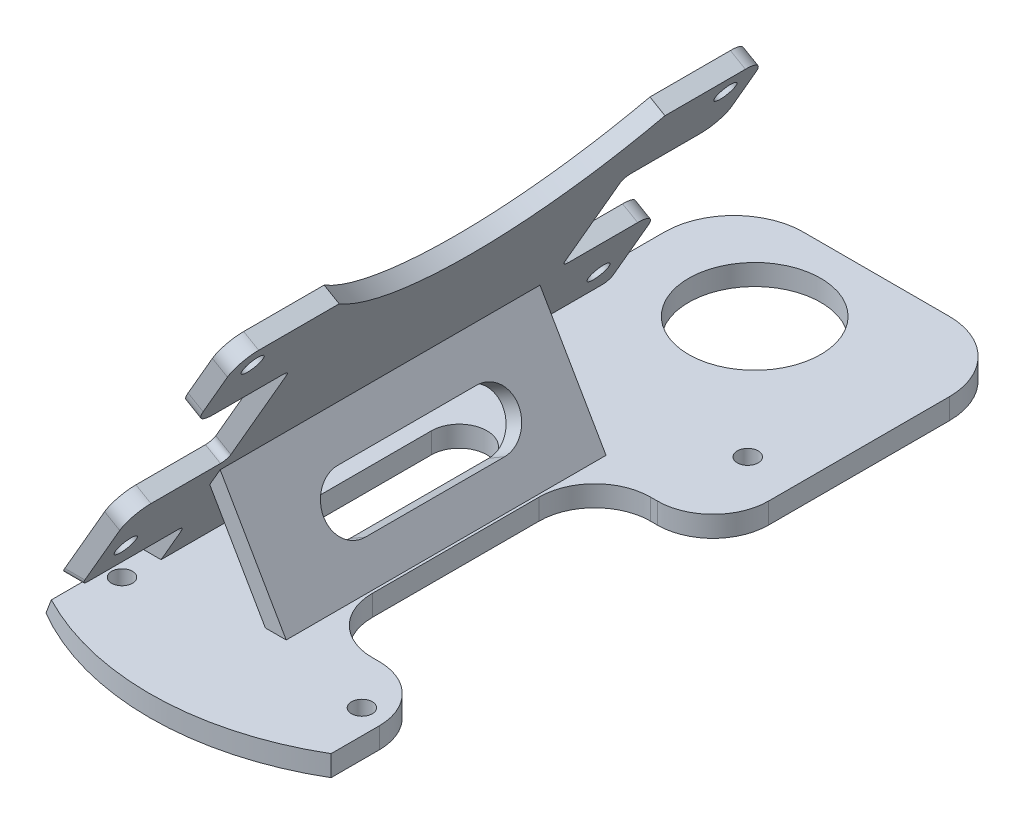
from build123d import *

# Parameters (mm, degrees)
EXTRUDE_1_DEPTH      = 38
EXTRUDE_1_DEPTH_BACK = 38
EXTRUDE_2_DEPTH      = 60
SKETCH_4_R           = 1.5
SKETCH_4_W           = 14
SKETCH_4_H           = 18
CUT_EXTRUDE_1_DEPTH  = 6
CUT_EXTRUDE_3_DEPTH  = 14
FILLET_2_R           = 3
CUT_EXTRUDE_6_DEPTH  = 3
SKETCH_13_R          = 1.5
CUT_EXTRUDE_7_DEPTH  = 10
CUT_EXTRUDE_9_DEPTH  = 15
SKETCH_17_W          = 41
SKETCH_17_H          = 26
SKETCH_17_R          = 9.5
SKETCH_17_R_2        = 1.5
EXTRUDE_3_DEPTH      = 3
FILLET_3_R           = 10
SKETCH_18_W          = 17
SKETCH_18_H          = 40
CUT_EXTRUDE_10_DEPTH = 10
FILLET_4_R           = 8
CUT_EXTRUDE_11_DEPTH = 4
FILLET_5_R           = 1
CUT_EXTRUDE_12_DEPTH = 10


with BuildPart() as part:
    # 草图2 → 凸台-拉伸1 (new, two sides: drawn at the far end of the back side and taken through both)
    with BuildSketch(Plane.XY.offset(-EXTRUDE_1_DEPTH_BACK)):
        Polygon((0, 0), (28.5, 49.363448016), (30.665063509, 48.113448016), (4.618802154, 3), (41, 3), (41, 0), align=None)
    extrude(amount=EXTRUDE_1_DEPTH + EXTRUDE_1_DEPTH_BACK)

    # 草图3 → 凸台-拉伸2 (add)
    with BuildSketch(Plane.XY.offset(38)):
        Polygon((12.618802154, 16.856406461), (14.118802154, 19.454482672), (23.618802154, 3), (20.618802154, 3), align=None)
    extrude(amount=-EXTRUDE_2_DEPTH)

    # 草图4 → 切除-拉伸1 (cut)
    with BuildSketch(Plane(origin=(0, 0, 0), x_dir=(0, 0, 1), z_dir=(-0.8660254037844365, 0.500000000000004, 0))):
        with Locations((34, 53.25)):
            Circle(SKETCH_4_R)
        with Locations((34, 16.75)):
            Circle(SKETCH_4_R)
        with Locations((-34, 16.75)):
            Circle(SKETCH_4_R)
        with Locations((-34, 53.25)):
            Circle(SKETCH_4_R)
        with Locations((31, 35)):
            Rectangle(SKETCH_4_W, SKETCH_4_H)
        with Locations((-31, 35)):
            Rectangle(SKETCH_4_W, SKETCH_4_H)
    extrude(amount=-CUT_EXTRUDE_1_DEPTH, mode=Mode.SUBTRACT)

    # 草图6 → 切除-拉伸3 (cut)
    with BuildSketch(Plane.XY.offset(38)):
        Polygon((23.618802154, 3), (14.118802154, 19.454482672), (12.618802154, 16.856406461), (20.618802154, 3), align=None)
    extrude(amount=-CUT_EXTRUDE_3_DEPTH, mode=Mode.SUBTRACT)

    # 圆角2
    fillet_2_edges = [part.edges().sort_by_distance(p)[0] for p in [
        (29.582531755, 48.738448016, -38),
        (23.082531755, 37.480117767, -38),
        (29.582531755, 48.738448016, 38),
        (23.082531755, 37.480117767, 38),
        (14.082531755, 21.891660498, 38),
        (14.082531755, 21.891660498, -38),
    ]]
    fillet(fillet_2_edges, radius=FILLET_2_R)

    # 草图11 → 切除-拉伸6 (cut)
    with BuildSketch(Plane(origin=(19.013139721, 10.977241336, 0), x_dir=(0, 0, -1), z_dir=(0.8660254037844374, 0.5000000000000022, 0))):
        with BuildLine():
            Line((-10, 4), (10, 4))
            ThreePointArc((10, 4), (14, 0), (10, -4))
            Line((10, -4), (-10, -4))
            ThreePointArc((-10, -4), (-14, 0), (-10, 4))
        make_face()
    extrude(amount=-CUT_EXTRUDE_6_DEPTH, mode=Mode.SUBTRACT)

    # 草图13 → 切除-拉伸7 (cut)
    with BuildSketch(Plane(origin=(0, 3, 0), x_dir=(1, 0, 0), z_dir=(0, 1, 0))):
        with Locations((37.5, -27)):
            Circle(SKETCH_13_R)
        with Locations((4, -28)):
            Circle(SKETCH_13_R)
        with Locations((34, 32)):
            Circle(SKETCH_13_R)
        with Locations((4, 32)):
            Circle(SKETCH_13_R)
    extrude(amount=-CUT_EXTRUDE_7_DEPTH, mode=Mode.SUBTRACT)

    # 草图15 → 切除-拉伸9 (cut)
    with BuildSketch(Plane.XY.offset(38)):
        Polygon((4.618802154, 3), (1.732050808, 3), (5.196152423, 9), (8.082903769, 9), align=None)
    cut_extrude_9 = extrude(amount=-CUT_EXTRUDE_9_DEPTH, mode=Mode.SUBTRACT)

    # 镜向1: 切除-拉伸9 across plane
    add(cut_extrude_9.mirror(Plane.XY), mode=Mode.SUBTRACT)

    # 草图17 → 凸台-拉伸3 (add)
    # profile 1 of 2: a face of its own
    with BuildSketch(Plane(origin=(0, 3, 0), x_dir=(1, 0, 0), z_dir=(0, 1, 0))):
        with Locations((20.5, 51)):
            Rectangle(SKETCH_17_W, SKETCH_17_H)
        with Locations((17, 50)):
            Circle(SKETCH_17_R, mode=Mode.SUBTRACT)
    # profile 2 of 2: a face of its own
    with BuildSketch(Plane(origin=(0, 3, 0), x_dir=(1, 0, 0), z_dir=(0, 1, 0))):
        with Locations((20.5, -51)):
            Rectangle(SKETCH_17_W, SKETCH_17_H)
        with Locations((5, -45)):
            Circle(SKETCH_17_R_2, mode=Mode.SUBTRACT)
        with Locations((5, -55)):
            Circle(SKETCH_17_R_2, mode=Mode.SUBTRACT)
        with Locations((35, -55)):
            Circle(SKETCH_17_R_2, mode=Mode.SUBTRACT)
        with Locations((35, -45)):
            Circle(SKETCH_17_R_2, mode=Mode.SUBTRACT)
        with Locations((20, -50)):
            Circle(SKETCH_17_R, mode=Mode.SUBTRACT)
    extrude(amount=-EXTRUDE_3_DEPTH)

    # 圆角3
    fillet_3_edges = [part.edges().sort_by_distance(p)[0] for p in [
        (41, 1.5, -64),
        (0, 1.5, -64),
        (41, 1.5, 64),
        (0, 1.5, 64),
    ]]
    fillet(fillet_3_edges, radius=FILLET_3_R)

    # 草图18 → 切除-拉伸10 (cut)
    with BuildSketch(Plane(origin=(0, 3, 0), x_dir=(1, 0, 0), z_dir=(0, 1, 0))):
        with Locations((32.5, 0)):
            Rectangle(SKETCH_18_W, SKETCH_18_H)
        with BuildLine():
            Line((8, -12.5), (8, 12.5))
            ThreePointArc((8, 12.5), (12, 16.5), (16, 12.5))
            Line((16, 12.5), (16, -12.5))
            ThreePointArc((16, -12.5), (12, -16.5), (8, -12.5))
        make_face()
    extrude(amount=-CUT_EXTRUDE_10_DEPTH, mode=Mode.SUBTRACT)

    # 圆角4
    fillet_4_edges = [part.edges().sort_by_distance(p)[0] for p in [
        (41, 1.5, -20),
        (24, 1.5, -20),
        (24, 1.5, 20),
        (41, 1.5, 20),
    ]]
    fillet(fillet_4_edges, radius=FILLET_4_R)

    # 草图21 → 切除-拉伸11 (cut)
    with BuildSketch(Plane(origin=(0, 0, 0), x_dir=(0, 0, 1), z_dir=(-0.8660254037844364, 0.5000000000000041, 0))):
        with BuildLine():
            Line((-23.430749028, 57), (23.430749028, 57))
            ThreePointArc((23.430749028, 57), (0, 48), (-23.430749028, 57))
        make_face()
        with BuildLine():
            Line((-8, 19), (8, 19))
            ThreePointArc((8, 19), (12, 15), (8, 11))
            Line((8, 11), (-8, 11))
            ThreePointArc((-8, 11), (-12, 15), (-8, 19))
        make_face()
    extrude(amount=-CUT_EXTRUDE_11_DEPTH, mode=Mode.SUBTRACT)

    # 圆角5
    fillet_5_edges = [part.edges().sort_by_distance(p)[0] for p in [
        (6.639528096, 9, -23),
        (6.639528096, 9, 23),
        (14.082531755, 21.891660498, 24),
        (23.082531755, 37.480117767, 24),
        (14.082531755, 21.891660498, -24),
        (23.082531755, 37.480117767, -24),
        (6.639528096, 9, 38),
        (6.639528096, 9, -38),
    ]]
    fillet(fillet_5_edges, radius=FILLET_5_R)

    # 草图22 → 切除-拉伸12 (cut)
    with BuildSketch(Plane(origin=(0, 3, 0), x_dir=(1, 0, 0), z_dir=(0, 1, 0))):
        with BuildLine():
            Line((0, -34.931397069), (0, -65.97672588))
            Line((0, -65.97672588), (41, -65.97672588))
            Line((41, -65.97672588), (41, -34.931397069))
            ThreePointArc((41, -34.931397069), (20.5, -40.502499938), (0, -34.931397069))
        make_face()
    extrude(amount=-CUT_EXTRUDE_12_DEPTH, mode=Mode.SUBTRACT)


solid = part.part
